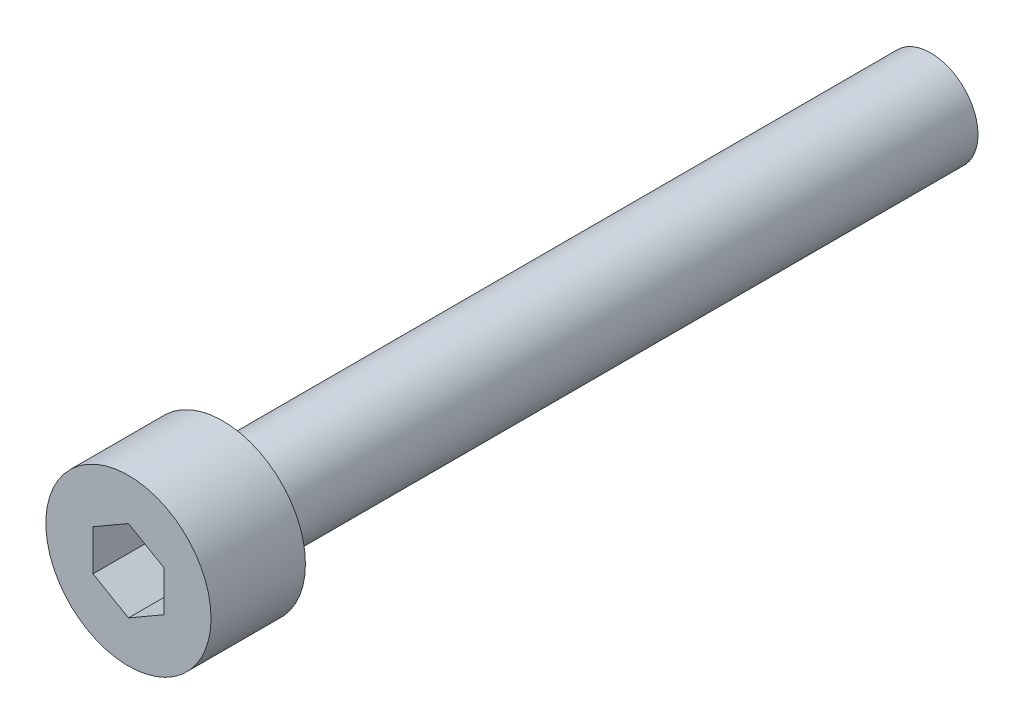
from build123d import *

# Parameters (mm, degrees)
THREAD_ENVELOPE_START = -30
PROFILE_1_R           = 2
THREAD_ENVELOPE_DEPTH = 30
PROFILE_2_R           = 3.5
SOCKET_HEAD_DEPTH     = 4


with BuildPart() as part:
    # Profile_1 → Thread_envelope (new body)
    with BuildSketch(Plane.XY.offset(THREAD_ENVELOPE_START)):
        Circle(PROFILE_1_R)
    extrude(amount=THREAD_ENVELOPE_DEPTH)

    # Profile_2 → Socket_head (add)
    with BuildSketch(Plane.XY):
        Circle(PROFILE_2_R)
        Polygon((1.5, 0.866025404), (0, 1.732050808), (-1.5, 0.866025404), (-1.5, -0.866025404), (0, -1.732050808), (1.5, -0.866025404), align=None, mode=Mode.SUBTRACT)
    extrude(amount=SOCKET_HEAD_DEPTH)


solid = part.part
